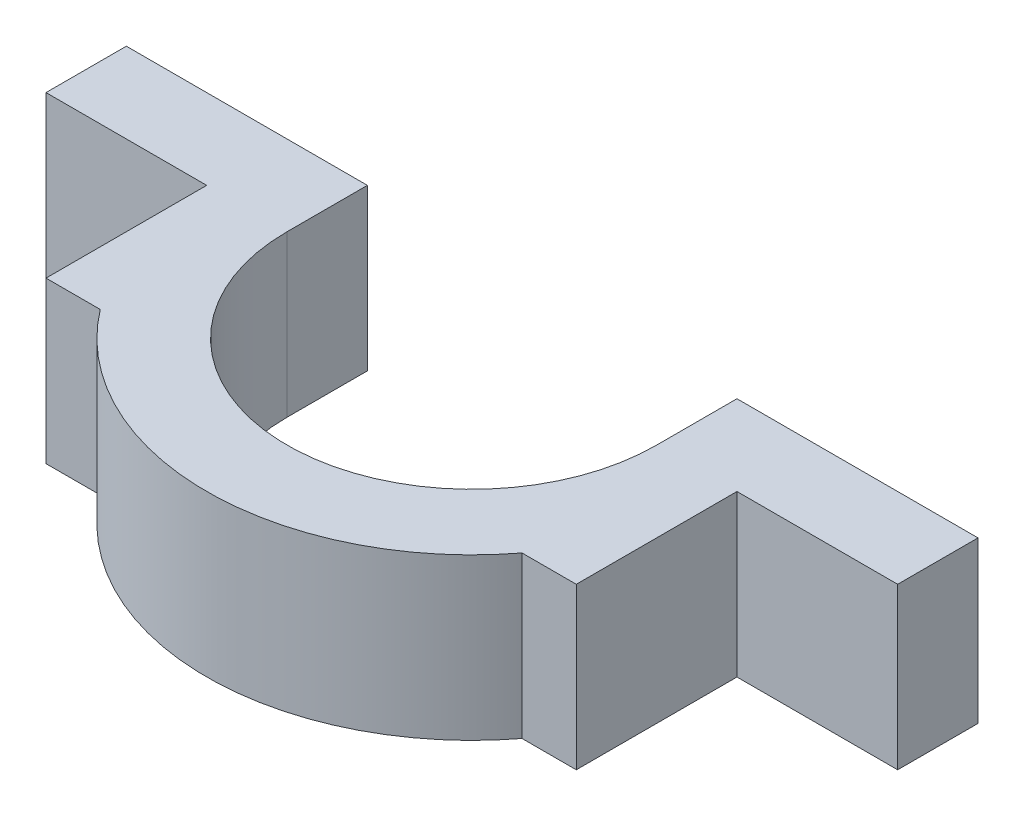
from build123d import *

# Parameters (mm, degrees)
EXTRUDE_1_DEPTH = 10


with BuildPart() as part:
    # Эскиз1 → Бобышка-Вытянуть1 (new body)
    with BuildSketch(Plane(origin=(0, 0, 0), x_dir=(1, 0, 0), z_dir=(0, 1, 0))):
        with BuildLine():
            Line((-16.5, 0), (-16.5, -10))
            Line((-16.5, -10), (-13.124404748, -10))
            ThreePointArc((-13.124404748, -10), (0, -16.5), (13.124404748, -10))
            Line((13.124404748, -10), (16.5, -10))
            Line((16.5, -10), (16.5, 0))
            Line((16.5, 0), (26.5, 0))
            Line((26.5, 0), (26.5, 5))
            Line((26.5, 5), (11.5, 5))
            Line((11.5, 5), (11.5, 0))
            ThreePointArc((11.5, 0), (0, -11.5), (-11.5, 0))
            Line((-11.5, 0), (-11.5, 5))
            Line((-11.5, 5), (-26.5, 5))
            Line((-26.5, 5), (-26.5, 0))
            Line((-26.5, 0), (-16.5, 0))
        make_face()
    extrude(amount=EXTRUDE_1_DEPTH)


solid = part.part
